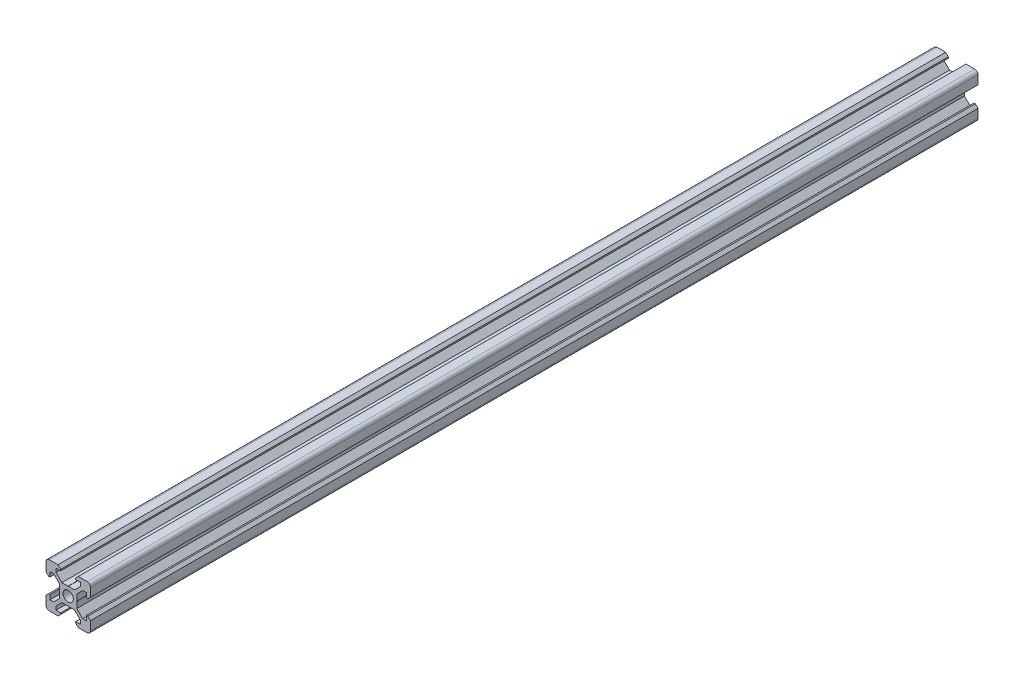
from build123d import *

# Parameters (mm, degrees)
SKETCH1_R           = 2.3
BOSS_EXTRUDE1_DEPTH = 200
CUT_EXTRUDE1_DEPTH  = 400
CIRPATTERN1_COUNT   = 4
FILLET1_R           = 1.5


with BuildPart() as part:
    # Sketch1 → Boss-Extrude1 (new, symmetric)
    with BuildSketch(Plane.XY):
        Polygon((-2.839339828, 3.9), (-5.5, 6.560660172), (-5.5, 8.2), (-3.395, 8.2), (-3.395, 8.815), (-4.58, 10), (-10, 10), (-10, 4.58), (-8.815, 3.395), (-8.2, 3.395), (-8.2, 5.5), (-6.560660172, 5.5), (-3.9, 2.839339828), (-3.9, 0), (-3.9, -2.839339828), (-6.560660172, -5.5), (-8.2, -5.5), (-8.2, -3.395), (-8.815, -3.395), (-10, -4.58), (-10, -10), (-4.58, -10), (-3.395, -8.815), (-3.395, -8.2), (-5.5, -8.2), (-5.5, -6.560660172), (-2.839339828, -3.9), (0, -3.9), (2.839339828, -3.9), (5.5, -6.560660172), (5.5, -8.2), (3.395, -8.2), (3.395, -8.815), (4.58, -10), (10, -10), (10, -4.58), (8.815, -3.395), (8.2, -3.395), (8.2, -5.5), (6.560660172, -5.5), (3.9, -2.839339828), (3.9, 0), (3.9, 2.839339828), (6.560660172, 5.5), (8.2, 5.5), (8.2, 3.395), (8.815, 3.395), (10, 4.58), (10, 10), (4.58, 10), (3.395, 8.815), (3.395, 8.2), (5.5, 8.2), (5.5, 6.560660172), (2.839339828, 3.9), (0, 3.9), align=None)
        Circle(SKETCH1_R, mode=Mode.SUBTRACT)
    extrude(amount=BOSS_EXTRUDE1_DEPTH, both=True)

    # Sketch2 → Cut-Extrude1 (cut)
    with BuildSketch(Plane.XY.offset(200)):
        with BuildLine():
            Line((-0.019015758, 3.804921208), (-0.05, 3.9))
            Line((-0.05, 3.9), (0.05, 3.9))
            Line((0.05, 3.9), (0.019015758, 3.804921208))
            ThreePointArc((0.019015758, 3.804921208), (0, 3.791118056), (-0.019015758, 3.804921208))
        make_face()
    cut_extrude1 = extrude(amount=-CUT_EXTRUDE1_DEPTH, mode=Mode.SUBTRACT)

    # CirPattern1: Cut-Extrude1 ×4 about axis
    cirpattern1_axis = Axis((0, 0, 0), (0, 0, 1))
    for i in range(1, CIRPATTERN1_COUNT):
        add(cut_extrude1.rotate(cirpattern1_axis, i * 360 / CIRPATTERN1_COUNT), mode=Mode.SUBTRACT)

    # Fillet1
    fillet1_edges = [part.edges().sort_by_distance(p)[0] for p in [
        (10, 10, 0),
        (10, -10, 0),
        (-10, -10, 0),
        (-10, 10, 0),
    ]]
    fillet(fillet1_edges, radius=FILLET1_R)


solid = part.part
